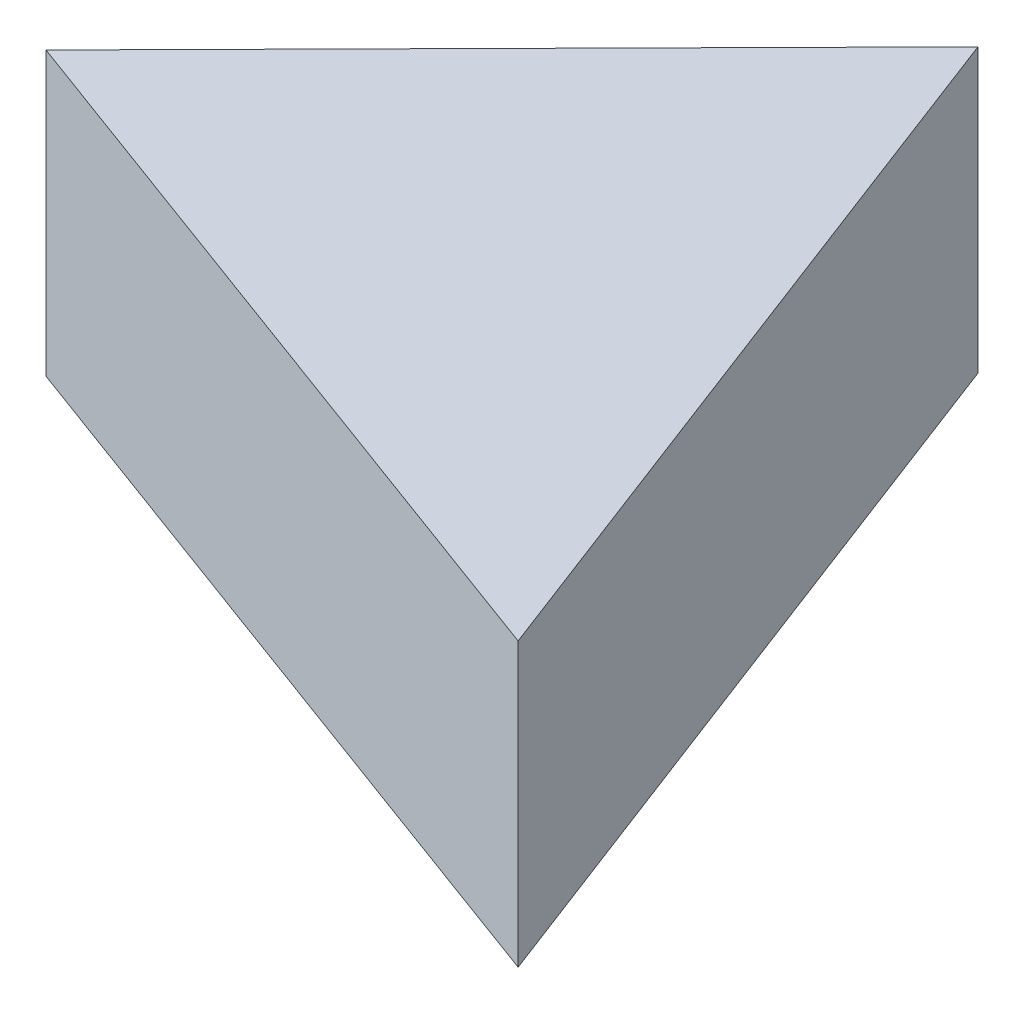
from build123d import *

# Parameters (mm, degrees)
EXTRUDE1_DEPTH = 34


with BuildPart() as part:
    # Sketch1 → Extrude1 (new body)
    with BuildSketch(Plane(origin=(0, 0, 0), x_dir=(1, 0, 0), z_dir=(0, 1, 0))):
        Polygon((12.127097366, 33.378753207), (-43.61542049, -23.031339713), (46.374892578, -56.210210657), align=None)
    extrude(amount=EXTRUDE1_DEPTH)


solid = part.part
